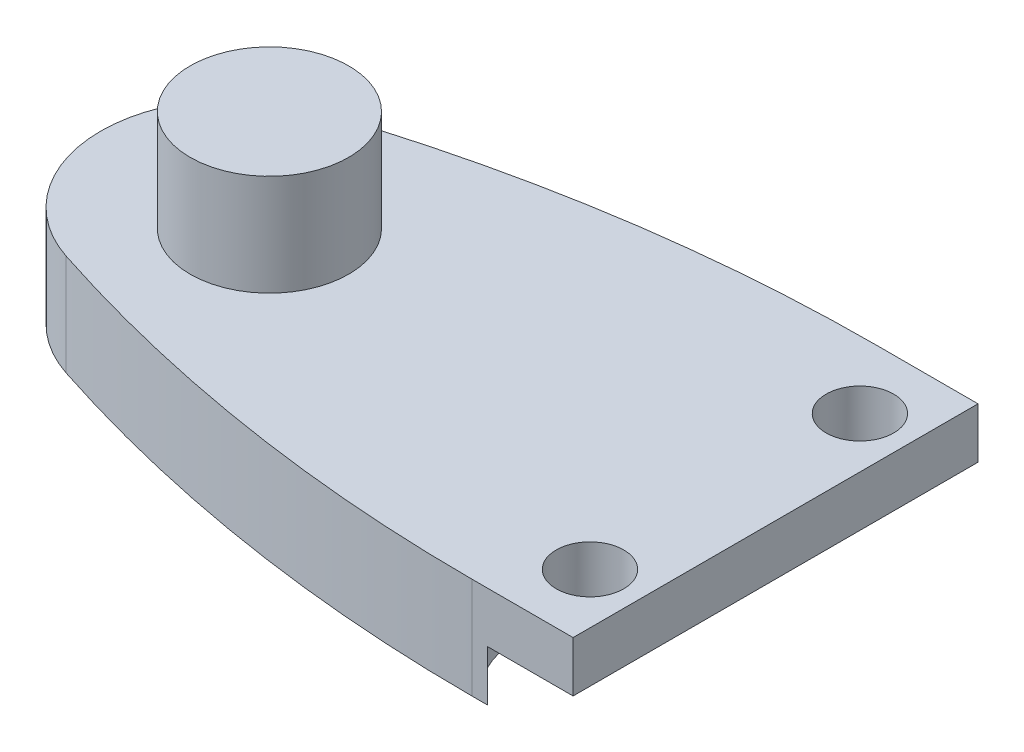
from build123d import *

# Parameters (mm, degrees)
BOSS_EXTRUDE1_DEPTH     = 3
ESQUISSE3_R             = 2.35
BOSS_EXTRU_2_DEPTH      = 3
ESQUISSE4_R             = 1
ENL_V_MAT_EXTRU_1_DEPTH = 10
ENL_V_MAT_EXTRU_2_DEPTH = 1.5


with BuildPart() as part:
    # Sketch1 → Boss-Extrude1 (new body)
    with BuildSketch(Plane(origin=(0, 0, 0), x_dir=(1, 0, 0), z_dir=(0, 1, 0))):
        with BuildLine():
            Line((15, 6), (12, 6))
            ThreePointArc((12, 6), (4.759909364, 5.427135296), (-2.3, 3.72279784))
            ThreePointArc((-2.3, 3.72279784), (-5, 0), (-2.3, -3.72279784))
            ThreePointArc((-2.3, -3.72279784), (4.759909364, -5.427135296), (12, -6))
            Line((12, -6), (15, -6))
            Line((15, -6), (15, 6))
        make_face()
    extrude(amount=-BOSS_EXTRUDE1_DEPTH)

    # Esquisse3 → Boss.-Extru.2 (add)
    with BuildSketch(Plane(origin=(0, 0, 0), x_dir=(1, 0, 0), z_dir=(0, 1, 0))):
        with Locations(Location((0, 0, 0), (0, 0, 270))):
            Circle(ESQUISSE3_R)
    extrude(amount=BOSS_EXTRU_2_DEPTH)

    # Esquisse4 → Enlèv. mat.-Extru.1 (cut)
    with BuildSketch(Plane(origin=(0, 0, 0), x_dir=(1, 0, 0), z_dir=(0, 1, 0))):
        with Locations(Location((13.5, -4, 0), (0, 0, 270))):
            Circle(ESQUISSE4_R)
        with Locations(Location((13.5, 4, 0), (0, 0, 270))):
            Circle(ESQUISSE4_R)
    extrude(amount=-ENL_V_MAT_EXTRU_1_DEPTH, mode=Mode.SUBTRACT)

    # Esquisse5 → Enlèv. mat.-Extru.2 (cut)
    with BuildSketch(Plane.XZ.offset(3)):
        with BuildLine():
            Line((13.5, 6.25), (13.5, 10.037760659))
            Line((13.5, 10.037760659), (19.160989733, 10.037760659))
            Line((19.160989733, 10.037760659), (18.711161689, -10.096981605))
            Line((18.711161689, -10.096981605), (13.5, -10.096981605))
            Line((13.5, -10.096981605), (13.5, -6.25))
            ThreePointArc((13.5, -6.25), (11.25, -4), (13.5, -1.75))
            Line((13.5, -1.75), (13.5, 1.75))
            ThreePointArc((13.5, 1.75), (11.25, 4), (13.5, 6.25))
        make_face()
    extrude(amount=-ENL_V_MAT_EXTRU_2_DEPTH, mode=Mode.SUBTRACT)


solid = part.part
